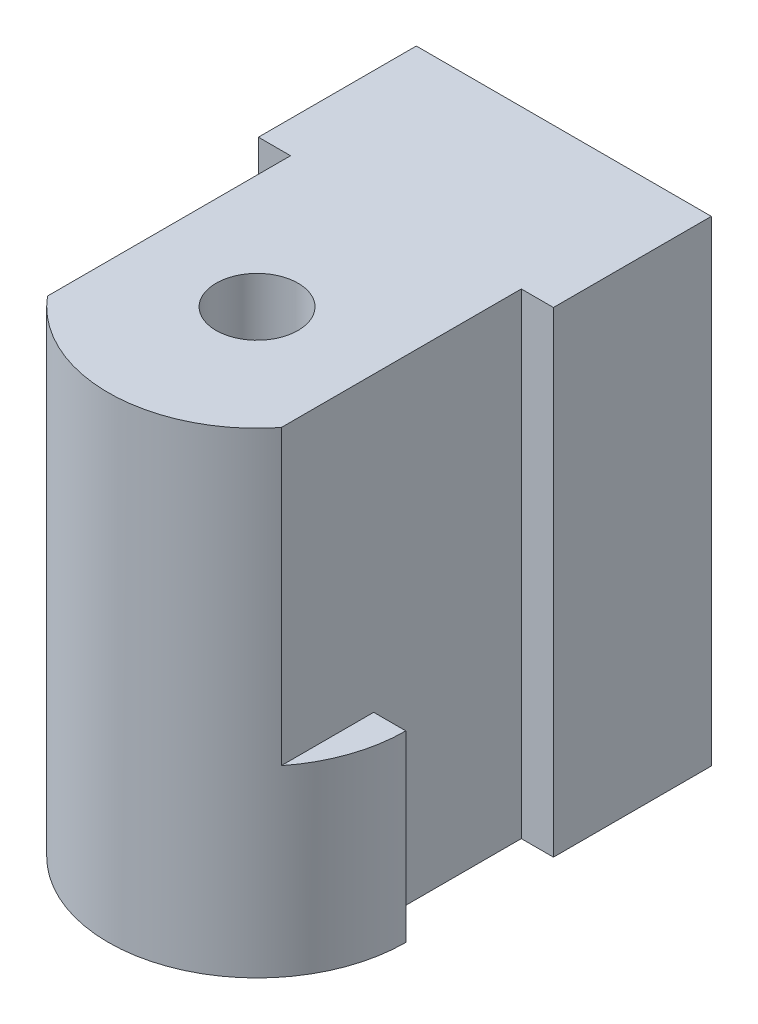
from build123d import *

# Parameters (mm, degrees)
SKETCH2_R                                      = 12.7
BOSS_EXTRUDE6_DEPTH                            = 40.64
SKETCH3_R                                      = 3.5
CUT_EXTRUDE1_DEPTH                             = 40.64
SKETCH4_R                                      = 1.778
CUT_EXTRUDE2_DEPTH                             = 6
BOSS_EXTRUDE8_DEPTH                            = 10
SKETCH8_W                                      = 25.185693912
SKETCH8_H                                      = 10
BOSS_EXTRUDE9_DEPTH                            = 7.284789049
BOSS_EXTRUDE10_DEPTH                           = 30.64
CSK_FOR_M3_FLAT_HEAD_MACHINE_SCREW1_AT_2_COUNT = 2
CSK_FOR_M3_FLAT_HEAD_MACHINE_SCREW1_AT_2_PITCH = 9.039543014
CSK_FOR_M3_FLAT_HEAD_MACHINE_SCREW1_AT_3_COUNT = 2
CSK_FOR_M3_FLAT_HEAD_MACHINE_SCREW1_AT_3_PITCH = 9.039543014
SKETCH16_W                                     = 3.769994858
SKETCH16_H                                     = 22.000968128
CUT_EXTRUDE3_DEPTH                             = 25
SKETCH17_W                                     = 10.276759259
SKETCH17_H                                     = 15.64
CUT_EXTRUDE4_DEPTH                             = 2.743753899
SKETCH18_W                                     = 12.6
SKETCH18_H                                     = 15.64
CUT_EXTRUDE5_DEPTH                             = 2.743753899


with BuildPart() as part:
    # Sketch2 → Boss-Extrude6 (new body)
    with BuildSketch(Plane(origin=(0, -2111.389926236, 0), x_dir=(1, 0, 0), z_dir=(0, 1, 0))):
        with Locations(Location((-53.693967541, 163.840329354, 0), (0, 0, 180))):
            Circle(SKETCH2_R)
    extrude(amount=BOSS_EXTRUDE6_DEPTH)

    # Sketch3 → Cut-Extrude1 (cut)
    with BuildSketch(Plane(origin=(0, -2070.749926236, 0), x_dir=(1, 0, 0), z_dir=(0, 1, 0))):
        with Locations(Location((-53.693967541, 163.840329354, 0), (0, 0, 270))):
            Circle(SKETCH3_R)
    extrude(amount=-CUT_EXTRUDE1_DEPTH, mode=Mode.SUBTRACT)

    # Sketch4 → Cut-Extrude2 (cut)
    with BuildSketch(Plane.XZ.offset(2111.389926236)):
        with Locations(Location((-61.942859512, -159.077829354, 0), (0, 0, 270))):
            Circle(SKETCH4_R)
        with Locations(Location((-53.693967541, -173.365329354, 0), (0, 0, 270))):
            Circle(SKETCH4_R)
        with Locations(Location((-45.44507557, -159.077829354, 0), (0, 0, 270))):
            Circle(SKETCH4_R)
    extrude(amount=-CUT_EXTRUDE2_DEPTH, mode=Mode.SUBTRACT)

    # Sketch7 → Boss-Extrude8 (add)
    with BuildSketch(Plane.XZ.offset(2111.389926236)):
        with BuildLine():
            Line((-40.993967541, -163.840329354), (-40.993967541, -182.634287878))
            Line((-40.993967541, -182.634287878), (-66.179661453, -182.634287878))
            Line((-66.179661453, -182.634287878), (-66.179661453, -166.163570095))
            ThreePointArc((-66.179661453, -166.163570095), (-52.527415502, -176.486639343), (-40.993967541, -163.840329354))
        make_face()
    extrude(amount=-BOSS_EXTRUDE8_DEPTH)

    # Sketch8 → Boss-Extrude9 (add)
    with BuildSketch(Plane(origin=(0, 0, -182.634287878), x_dir=(-1, 0, 0), z_dir=(0, 0, -1))):
        with Locations((53.586814497, -2106.389926236)):
            Rectangle(SKETCH8_W, SKETCH8_H)
    extrude(amount=BOSS_EXTRUDE9_DEPTH)

    # Sketch9 → Boss-Extrude10 (add)
    with BuildSketch(Plane(origin=(0, -2070.749926236, 0), x_dir=(1, 0, 0), z_dir=(0, 1, 0))):
        with BuildLine():
            Line((-66.179661453, 163.840329354), (-66.179661453, 189.919076927))
            Line((-66.179661453, 189.919076927), (-40.993967541, 189.919076927))
            Line((-40.993967541, 189.919076927), (-40.993967541, 163.840329354))
            ThreePointArc((-40.993967541, 163.840329354), (-53.586814497, 176.43317631), (-66.179661453, 163.840329354))
        make_face()
    extrude(amount=-BOSS_EXTRUDE10_DEPTH)

    # Sketch15 → CSK for M3 Flat Head Machine Screw1 (revolve, cut)
    with BuildSketch(Plane(origin=(-53.586814498, -2075.749926236, -189.919076927), x_dir=(0, 1, 0), z_dir=(1, 0, 0))):
        Polygon((0, 0), (0, 10), (1.7, 8.978536948), (1.7, 1.45), (3.15, 0), align=None)
    csk_for_m3_flat_head_machine_screw1 = revolve(axis=Axis((-53.586814498, -2075.749926236, -196.269076927), (0, 0, 1)), mode=Mode.SUBTRACT)

    # CSK for M3 Flat Head Machine Screw1 at 2: CSK for M3 Flat Head Machine Screw1 ×2
    with Locations(*[(-i * CSK_FOR_M3_FLAT_HEAD_MACHINE_SCREW1_AT_2_PITCH, 0, 0) for i in range(1, CSK_FOR_M3_FLAT_HEAD_MACHINE_SCREW1_AT_2_COUNT)]):
        add(csk_for_m3_flat_head_machine_screw1, mode=Mode.SUBTRACT)

    # CSK for M3 Flat Head Machine Screw1 at 3: CSK for M3 Flat Head Machine Screw1 ×2
    with Locations(*[(i * CSK_FOR_M3_FLAT_HEAD_MACHINE_SCREW1_AT_3_PITCH, 0, 0) for i in range(1, CSK_FOR_M3_FLAT_HEAD_MACHINE_SCREW1_AT_3_COUNT)]):
        add(csk_for_m3_flat_head_machine_screw1, mode=Mode.SUBTRACT)

    # Mirror1: CSK for M3 Flat Head Machine Screw1 across plane
    add(csk_for_m3_flat_head_machine_screw1.mirror(Plane.ZX.offset(-2091.069926234)), mode=Mode.SUBTRACT)

    # Mirror1 copy 1 sketch → Mirror1 copy 1 (revolve, cut)
    with BuildSketch(Plane(origin=(-62.626357512, -2106.389926232, -189.919076927), x_dir=(0, -1, 0), z_dir=(1, 0, 0))):
        Polygon((0, 0), (0, -10), (1.7, -8.978536948), (1.7, -1.45), (3.15, 0), align=None)
    revolve(axis=Axis((-62.626357512, -2106.389926232, -196.269076927), (0, 0, -1)), mode=Mode.SUBTRACT)

    # Mirror1 copy 2 sketch → Mirror1 copy 2 (revolve, cut)
    with BuildSketch(Plane(origin=(-44.547271484, -2106.389926232, -189.919076927), x_dir=(0, -1, 0), z_dir=(1, 0, 0))):
        Polygon((0, 0), (0, -10), (1.7, -8.978536948), (1.7, -1.45), (3.15, 0), align=None)
    revolve(axis=Axis((-44.547271484, -2106.389926232, -196.269076927), (0, 0, -1)), mode=Mode.SUBTRACT)

    # Sketch16 → Cut-Extrude3 (cut)
    with BuildSketch(Plane(origin=(0, -2070.749926236, 0), x_dir=(1, 0, 0), z_dir=(0, 1, 0))):
        with Locations((-65.320904983, 165.43984529)):
            Rectangle(SKETCH16_W, SKETCH16_H)
        with Locations((-41.852724011, 165.43984529)):
            Rectangle(SKETCH16_W, SKETCH16_H)
    extrude(amount=-CUT_EXTRUDE3_DEPTH, mode=Mode.SUBTRACT)

    # Sketch17 → Cut-Extrude4 (cut)
    with BuildSketch(Plane.ZY.offset(66.179661453)):
        with Locations((-171.301949724, -2103.569926236)):
            Rectangle(SKETCH17_W, SKETCH17_H)
    extrude(amount=-CUT_EXTRUDE4_DEPTH, mode=Mode.SUBTRACT)

    # Sketch18 → Cut-Extrude5 (cut)
    with BuildSketch(Plane(origin=(-40.993967541, 0, 0), x_dir=(0, 0, -1), z_dir=(1, 0, 0))):
        with Locations((170.140329354, -2103.569926236)):
            Rectangle(SKETCH18_W, SKETCH18_H)
    extrude(amount=-CUT_EXTRUDE5_DEPTH, mode=Mode.SUBTRACT)


solid = part.part
